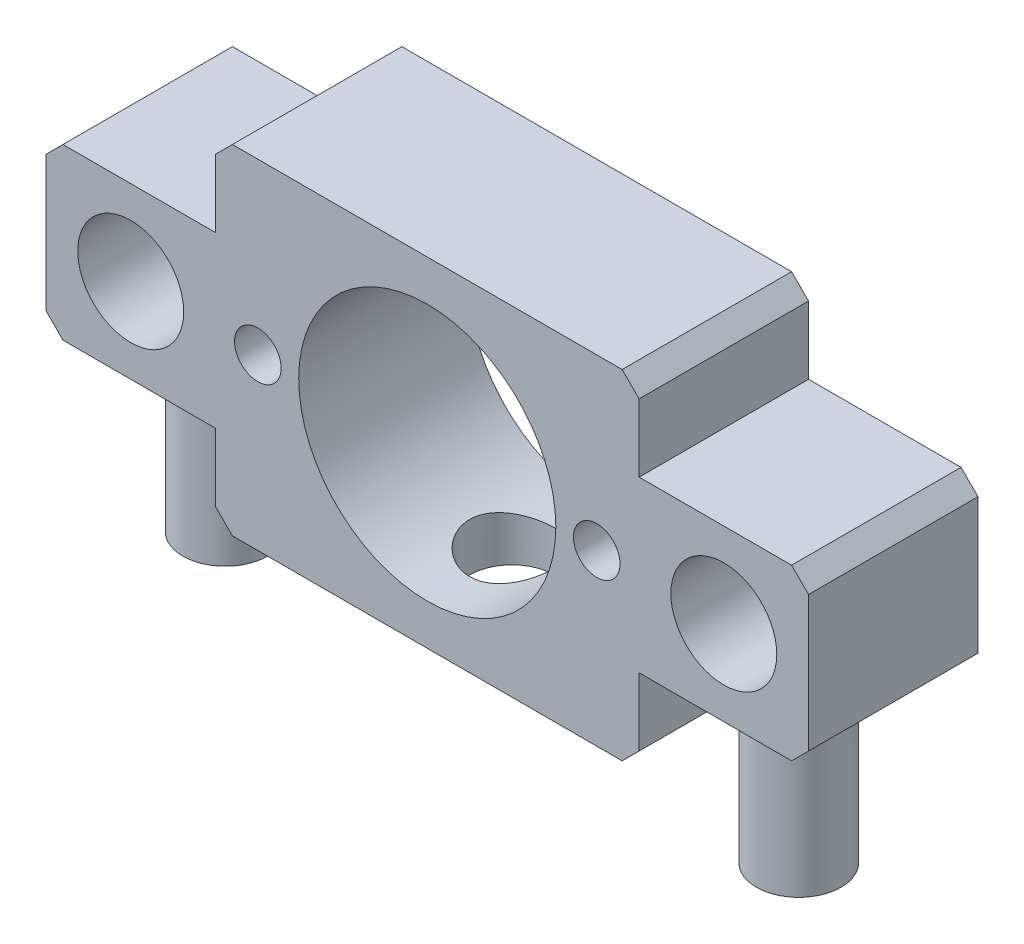
from build123d import *

# Parameters (mm, degrees)
SKETCH1_W                       = 90
SKETCH1_H                       = 40
BOSS_EXTRUDE1_DEPTH             = 20
SKETCH2_W                       = 20
SKETCH2_H                       = 10
CUT_EXTRUDE1_DEPTH              = 54.150729064
SKETCH3_W                       = 20
SKETCH3_H                       = 10
CUT_EXTRUDE2_DEPTH              = 54.150729064
SKETCH4_W                       = 20
SKETCH4_H                       = 10
CUT_EXTRUDE3_DEPTH              = 54.150729064
SKETCH5_W                       = 20
SKETCH5_H                       = 10
CUT_EXTRUDE4_DEPTH              = 54.150729064
F_5_0_5_DIAMETER_HOLE1_D        = 5
F_5_0_5_DIAMETER_HOLE1_DEPTH    = 12
M27_CLEARANCE_HOLE1_D           = 29.849192884
F_10_0_10_DIAMETER_HOLE1_REACH  = 63.033
F_10_0_10_DIAMETER_HOLE1_BORE_R = 5
F_12_0_12_DIAMETER_HOLE1_D      = 12
CHAMFER1_SIZE                   = 2
SKETCH18_R                      = 6.25
CUT_EXTRUDE6_DEPTH              = 100
SKETCH20_R                      = 15.175
CUT_EXTRUDE7_DEPTH              = 100
SKETCH21_R                      = 2.75
CUT_EXTRUDE8_DEPTH              = 12
SKETCH23_R                      = 5
BOSS_EXTRUDE2_DEPTH             = 20


with BuildPart() as part:
    # Sketch1 → Boss-Extrude1 (new body)
    with BuildSketch(Plane.XY.offset(10)):
        Rectangle(SKETCH1_W, SKETCH1_H)
    extrude(amount=-BOSS_EXTRUDE1_DEPTH)

    # Sketch2 → Cut-Extrude1 (cut, through all)
    with BuildSketch(Plane(origin=(0, 0, -10), x_dir=(-1, 0, 0), z_dir=(0, 0, -1))):
        with Locations((35, 15)):
            Rectangle(SKETCH2_W, SKETCH2_H)
    extrude(amount=-CUT_EXTRUDE1_DEPTH, mode=Mode.SUBTRACT)

    # Sketch3 → Cut-Extrude2 (cut, through all)
    with BuildSketch(Plane(origin=(0, 0, -10), x_dir=(-1, 0, 0), z_dir=(0, 0, -1))):
        with Locations((35, -15)):
            Rectangle(SKETCH3_W, SKETCH3_H)
    extrude(amount=-CUT_EXTRUDE2_DEPTH, mode=Mode.SUBTRACT)

    # Sketch4 → Cut-Extrude3 (cut, through all)
    with BuildSketch(Plane(origin=(0, 0, -10), x_dir=(-1, 0, 0), z_dir=(0, 0, -1))):
        with Locations((-35, -15)):
            Rectangle(SKETCH4_W, SKETCH4_H)
    extrude(amount=-CUT_EXTRUDE3_DEPTH, mode=Mode.SUBTRACT)

    # Sketch5 → Cut-Extrude4 (cut, through all)
    with BuildSketch(Plane(origin=(0, 0, -10), x_dir=(-1, 0, 0), z_dir=(0, 0, -1))):
        with Locations((-35, 15)):
            Rectangle(SKETCH5_W, SKETCH5_H)
    extrude(amount=-CUT_EXTRUDE4_DEPTH, mode=Mode.SUBTRACT)

    # Ø5.0 (5) Diameter Hole1
    with Locations(Plane.XY.offset(10)):
        with Locations((20, 0), (-20, 0)):
            Hole(F_5_0_5_DIAMETER_HOLE1_D / 2, depth=F_5_0_5_DIAMETER_HOLE1_DEPTH)

    # M27 Clearance Hole1 (through all)
    with Locations(Plane.XY.offset(10)):
        with Locations((0, 0)):
            Hole(M27_CLEARANCE_HOLE1_D / 2)

    # Ø10.0 (10) Diameter Hole1 bore → Ø10.0 (10) Diameter Hole1 (cut, up to next)
    with BuildSketch(Plane(origin=(0, -20, 0), x_dir=(-1, 0, 0), z_dir=(0, -1, 0)), mode=Mode.PRIVATE) as f_10_0_10_diameter_hole1_sk1:
        Circle(F_10_0_10_DIAMETER_HOLE1_BORE_R)
    f_10_0_10_diameter_hole1_tool1 = extrude(f_10_0_10_diameter_hole1_sk1.sketch, amount=-F_10_0_10_DIAMETER_HOLE1_REACH, mode=Mode.PRIVATE) & part.part
    add(f_10_0_10_diameter_hole1_tool1.solids().sort_by_distance((0, -20, 0))[0], mode=Mode.SUBTRACT)

    # Ø12.0 (12) Diameter Hole1 (through all)
    with Locations(Plane(origin=(0, 0, -10), x_dir=(-1, 0, 0), z_dir=(0, 0, -1))):
        with Locations((35, 0), (-35, 0)):
            Hole(F_12_0_12_DIAMETER_HOLE1_D / 2)

    # Chamfer1
    chamfer1_edges = [part.edges().sort_by_distance(p)[0] for p in [
        (-25, 20, 0),
        (-45, 10, 0),
        (-45, -10, 0),
        (-25, -20, 0),
        (25, -20, 0),
        (45, -10, 0),
        (45, 10, 0),
        (25, 20, 0),
    ]]
    chamfer(chamfer1_edges, length=CHAMFER1_SIZE)

    # Sketch18 → Cut-Extrude6 (cut)
    with BuildSketch(Plane.XY.offset(10)):
        with Locations((-35, 0)):
            Circle(SKETCH18_R)
        with Locations((35, 0)):
            Circle(SKETCH18_R)
    extrude(amount=-CUT_EXTRUDE6_DEPTH, mode=Mode.SUBTRACT)

    # Sketch20 → Cut-Extrude7 (cut)
    with BuildSketch(Plane.XY.offset(10)):
        Circle(SKETCH20_R)
    extrude(amount=-CUT_EXTRUDE7_DEPTH, mode=Mode.SUBTRACT)

    # Sketch21 → Cut-Extrude8 (cut)
    with BuildSketch(Plane.XY.offset(10)):
        with Locations((-20, 0)):
            Circle(SKETCH21_R)
        with Locations(Location((20, 0, 0), (0, 0, 180))):
            Circle(SKETCH21_R)
    extrude(amount=-CUT_EXTRUDE8_DEPTH, mode=Mode.SUBTRACT)

    # Sketch23 → Boss-Extrude2 (add)
    with BuildSketch(Plane.XZ.offset(10)):
        with Locations(Location((-33.846356211, 0, 0), (0, 0, 90))):
            Circle(SKETCH23_R)
        with Locations(Location((33.846356211, 0, 0), (0, 0, 90))):
            Circle(SKETCH23_R)
    extrude(amount=BOSS_EXTRUDE2_DEPTH)


solid = part.part
